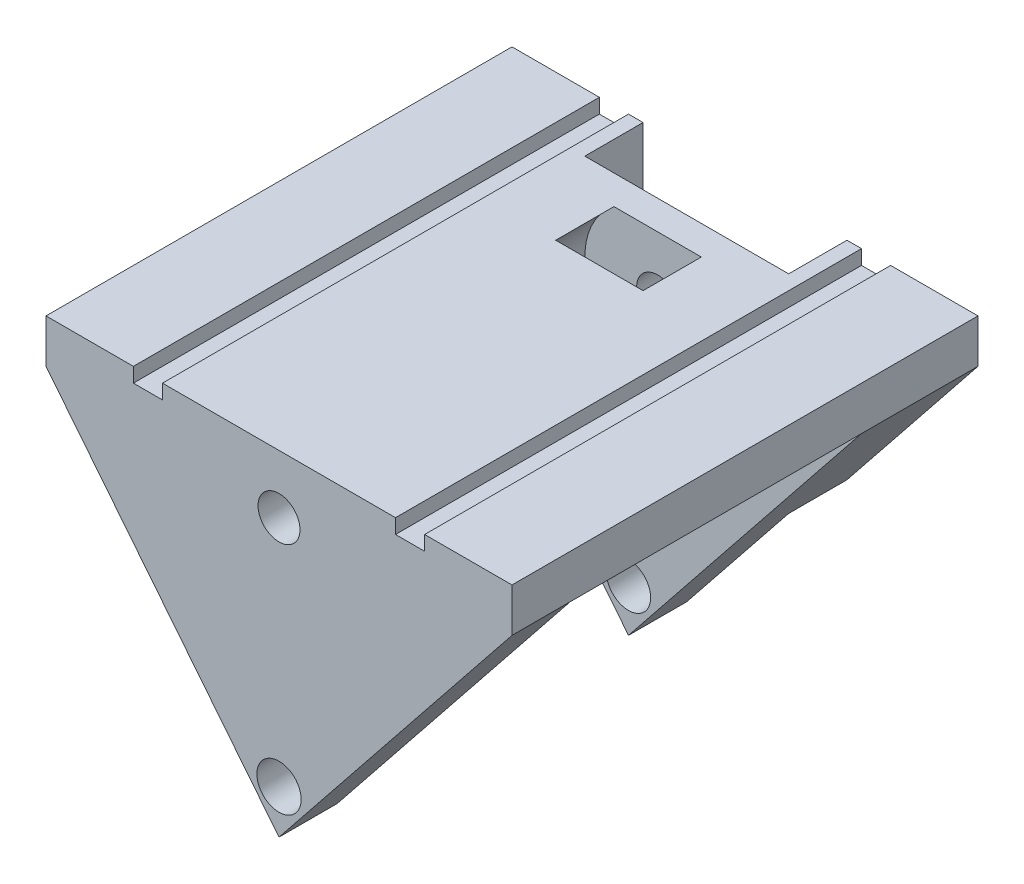
from build123d import *

# Parameters (mm, degrees)
SKETCH2_W               = 50.8
SKETCH2_H               = 50.8
BOSS_EXTRUDE1_DEPTH     = 4.7625
SKETCH3_W               = 3.175
SKETCH3_H               = 50.8
CUT_EXTRUDE1_DEPTH      = 1.5875
BOSS_EXTRUDE2_DEPTH     = 6.35
BOSS_EXTRUDE3_DEPTH     = 12.7
SKETCH6_W               = 22.225
SKETCH6_H               = 6.35
CUT_EXTRUDE2_DEPTH      = 44.45
SKETCH7_R               = 2.413
SKETCH7_R_2             = 2.286
CUT_EXTRUDE3_DEPTH      = 50.8
CUT_EXTRUDE4_DEPTH      = 3.175
CUT_EXTRUDE4_DEPTH_BACK = 3.175
SKETCH8_R               = 7.9375


with BuildPart() as part:
    # Sketch2 → Boss-Extrude1 (new body)
    with BuildSketch(Plane(origin=(0, 0, 0), x_dir=(1, 0, 0), z_dir=(0, 1, 0))):
        with Locations((25.4, 25.4)):
            Rectangle(SKETCH2_W, SKETCH2_H)
    extrude(amount=BOSS_EXTRUDE1_DEPTH)

    # Sketch3 → Cut-Extrude1 (cut)
    with BuildSketch(Plane(origin=(0, 4.7625, 0), x_dir=(1, 0, 0), z_dir=(0, 1, 0))):
        with Locations((11.1125, 25.4)):
            Rectangle(SKETCH3_W, SKETCH3_H)
        with Locations((39.6875, 25.4)):
            Rectangle(SKETCH3_W, SKETCH3_H)
    extrude(amount=-CUT_EXTRUDE1_DEPTH, mode=Mode.SUBTRACT)

    # Sketch4 → Boss-Extrude2 (add)
    with BuildSketch(Plane.XY):
        Polygon((50.8, 0), (25.4, 0), (25.4, -31.75), align=None)
        Polygon((25.4, 0), (0, 0), (25.4, -31.75), align=None)
    extrude(amount=-BOSS_EXTRUDE2_DEPTH)

    # Sketch5 → Boss-Extrude3 (add)
    with BuildSketch(Plane(origin=(0, 0, -50.8), x_dir=(-1, 0, 0), z_dir=(0, 0, -1))):
        Polygon((-25.4, 0), (-50.8, 0), (-25.4, -31.75), align=None)
        Polygon((0, 0), (-25.4, 0), (-25.4, -31.75), align=None)
    extrude(amount=-BOSS_EXTRUDE3_DEPTH)

    # Sketch6 → Cut-Extrude2 (cut)
    with BuildSketch(Plane(origin=(0, 4.7625, 0), x_dir=(1, 0, 0), z_dir=(0, 1, 0))):
        with Locations((25.4, 47.625)):
            Rectangle(SKETCH6_W, SKETCH6_H)
    extrude(amount=-CUT_EXTRUDE2_DEPTH, mode=Mode.SUBTRACT)

    # Sketch7 → Cut-Extrude3 (cut)
    with BuildSketch(Plane(origin=(0, 0, -44.45), x_dir=(-1, 0, 0), z_dir=(0, 0, -1))):
        with Locations((-25.4, -26.9875)):
            Circle(SKETCH7_R)
        with Locations((-25.4, -1.5875)):
            Circle(SKETCH7_R_2)
    extrude(amount=-CUT_EXTRUDE3_DEPTH, mode=Mode.SUBTRACT)

    # Sketch8 → Cut-Extrude4 (cut, two sides: drawn at the far end of the back side and taken through both)
    with BuildSketch(Plane.XY.offset(-38.1).offset(-CUT_EXTRUDE4_DEPTH_BACK)):
        with Locations((25.4, -1.5875)):
            Circle(SKETCH8_R)
    extrude(amount=CUT_EXTRUDE4_DEPTH + CUT_EXTRUDE4_DEPTH_BACK, mode=Mode.SUBTRACT)


solid = part.part
